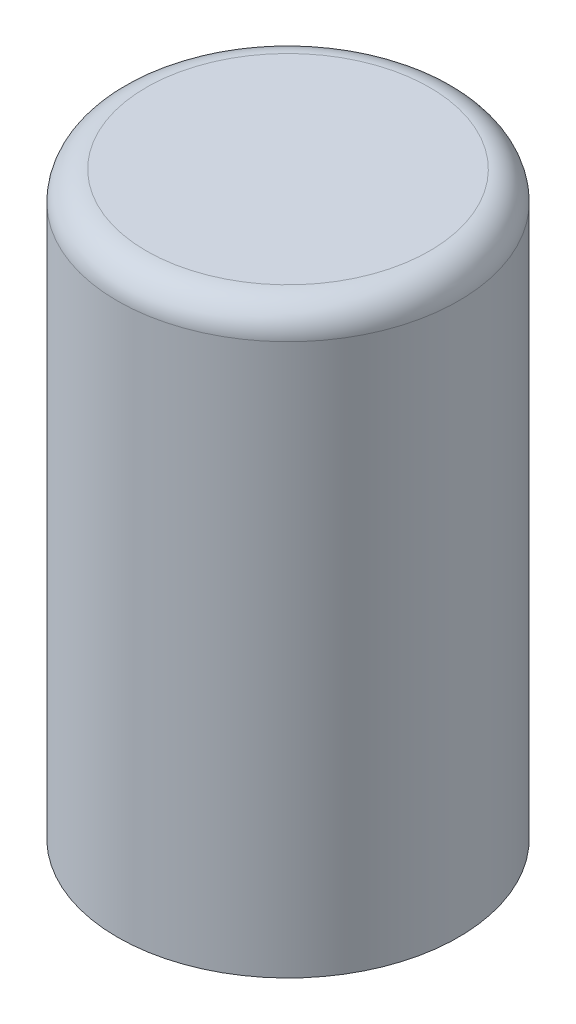
from build123d import *

# Parameters (mm, degrees)
SKETCH1_R           = 15
BOSS_EXTRUDE1_DEPTH = 51
FILLET1_R           = 2.54
SKETCH2_R           = 3.095
CUT_EXTRUDE1_DEPTH  = 12.7


with BuildPart() as part:
    # Sketch1 → Boss-Extrude1 (new body)
    with BuildSketch(Plane(origin=(0, 0, 0), x_dir=(1, 0, 0), z_dir=(0, 1, 0))):
        with Locations(Location((0, 0, 0), (0, 0, 270))):
            Circle(SKETCH1_R)
    extrude(amount=BOSS_EXTRUDE1_DEPTH)

    # Fillet1
    fillet1_edges = [part.edges().sort_by_distance(p)[0] for p in [
        (0, 51, -15),
    ]]
    fillet(fillet1_edges, radius=FILLET1_R)

    # Sketch2 → Cut-Extrude1 (cut)
    with BuildSketch(Plane.XZ):
        with Locations(Location((0, 0, 0), (0, 0, 270))):
            Circle(SKETCH2_R)
    extrude(amount=-CUT_EXTRUDE1_DEPTH, mode=Mode.SUBTRACT)


solid = part.part
